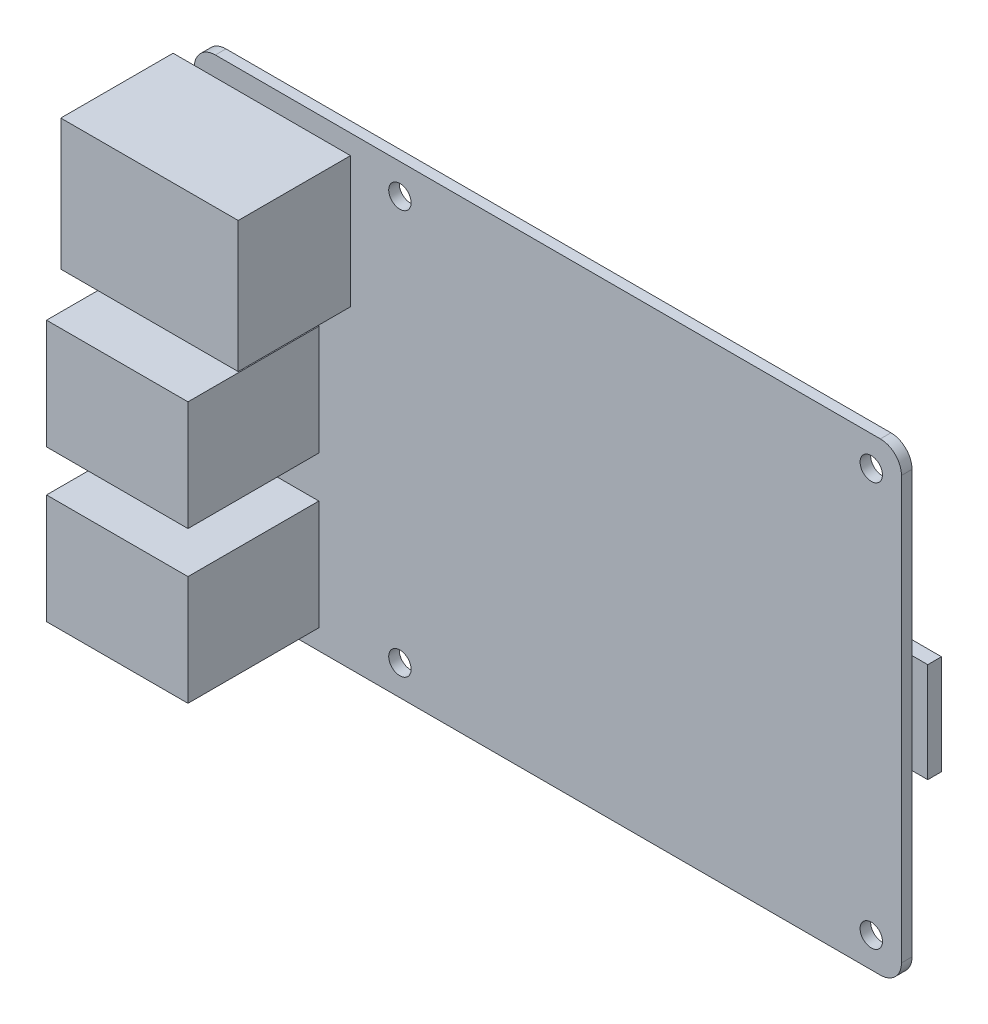
from build123d import *

# Parameters (mm, degrees)
SKETCH1_W           = 85.09
SKETCH1_H           = 55.88
BOSS_EXTRUDE1_DEPTH = 1.27
FILLET2_R           = 2.54
SKETCH2_R           = 1.3462
CUT_EXTRUDE1_DEPTH  = 1.27
SKETCH3_W           = 17.018
SKETCH3_H           = 13.208
BOSS_EXTRUDE2_DEPTH = 15.748
SKETCH4_W           = 21.3487
SKETCH4_H           = 15.748
BOSS_EXTRUDE3_DEPTH = 13.5128
SKETCH5_W           = 15.494
SKETCH5_H           = 11.9888
BOSS_EXTRUDE4_DEPTH = 1.651


with BuildPart() as part:
    # Sketch1 → Boss-Extrude1 (new body)
    with BuildSketch(Plane.XY):
        with Locations((42.545, 27.94)):
            Rectangle(SKETCH1_W, SKETCH1_H)
    extrude(amount=BOSS_EXTRUDE1_DEPTH)

    # Fillet2
    fillet2_edges = [part.edges().sort_by_distance(p)[0] for p in [
        (85.09, 0, 0.635),
        (0, 0, 0.635),
        (0, 55.88, 0.635),
        (85.09, 55.88, 0.635),
    ]]
    fillet(fillet2_edges, radius=FILLET2_R)

    # Sketch2 → Cut-Extrude1 (cut)
    with BuildSketch(Plane.XY.offset(1.27)):
        with Locations((81.4578, 52.2478)):
            Circle(SKETCH2_R)
        with Locations((24.7396, 52.2478)):
            Circle(SKETCH2_R)
        with Locations((24.7396, 3.6322)):
            Circle(SKETCH2_R)
        with Locations((81.4578, 3.6322)):
            Circle(SKETCH2_R)
    extrude(amount=-CUT_EXTRUDE1_DEPTH, mode=Mode.SUBTRACT)

    # Sketch3 → Boss-Extrude2 (add)
    with BuildSketch(Plane.XY.offset(1.27)):
        with Locations((6.477, 27.2288)):
            Rectangle(SKETCH3_W, SKETCH3_H)
        with Locations((6.477, 9.017)):
            Rectangle(SKETCH3_W, SKETCH3_H)
    extrude(amount=BOSS_EXTRUDE2_DEPTH)

    # Sketch4 → Boss-Extrude3 (add)
    with BuildSketch(Plane.XY.offset(1.27)):
        with Locations((8.12165, 45.6438)):
            Rectangle(SKETCH4_W, SKETCH4_H)
    extrude(amount=BOSS_EXTRUDE3_DEPTH)

    # Sketch5 → Boss-Extrude4 (add)
    with BuildSketch(Plane(origin=(0, 0, 0), x_dir=(-1, 0, 0), z_dir=(0, 0, -1))):
        with Locations((-79.2353, 27.94)):
            Rectangle(SKETCH5_W, SKETCH5_H)
    extrude(amount=BOSS_EXTRUDE4_DEPTH)


solid = part.part
